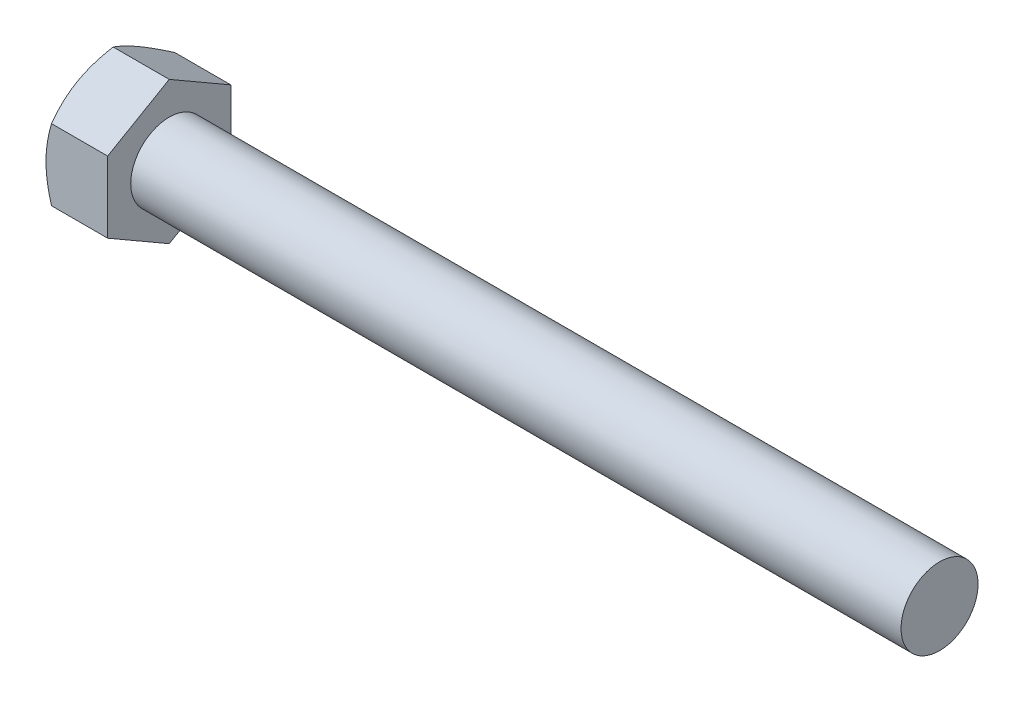
from build123d import *

# Parameters (mm, degrees)
SKETCH2_R     = 1.866050808
HEX_DIE_DEPTH = 1.6
SKETCH4_R     = 1.4
INDENT_DEPTH  = 0.2


with BuildPart() as part:
    # BodySke → Base-Revolve (revolve)
    with BuildSketch(Plane.XY, mode=Mode.PRIVATE) as base_revolve_sk:
        Polygon((1.6, 1), (1.6, 1.847575058), (0.142937526, 1.847575058), (0, 1.6), (0, 0), (21.6, 0), (21.6, 1), align=None)
    revolve(base_revolve_sk.sketch.rotate(Axis((-25.4, 0, 0), (1, 0, 0)), 90), axis=Axis((-25.4, 0, 0), (1, 0, 0)))

    # Sketch2 → Hex-Die (cut)
    with BuildSketch(Plane(origin=(0, 0, 0), x_dir=(0, 0, -1), z_dir=(1, 0, 0))):
        Circle(SKETCH2_R)
        Polygon((-1.6, 0.923760435), (0, 1.847520869), (1.6, 0.923760435), (1.6, -0.923760435), (0, -1.847520869), (-1.6, -0.923760435), align=None, mode=Mode.SUBTRACT)
    extrude(amount=HEX_DIE_DEPTH, mode=Mode.SUBTRACT)

    # Sketch4 → Indent (cut)
    with BuildSketch(Plane(origin=(0, 0, 0), x_dir=(0, 0, -1), z_dir=(1, 0, 0))):
        Circle(SKETCH4_R)
    extrude(amount=INDENT_DEPTH, mode=Mode.SUBTRACT)


solid = part.part
